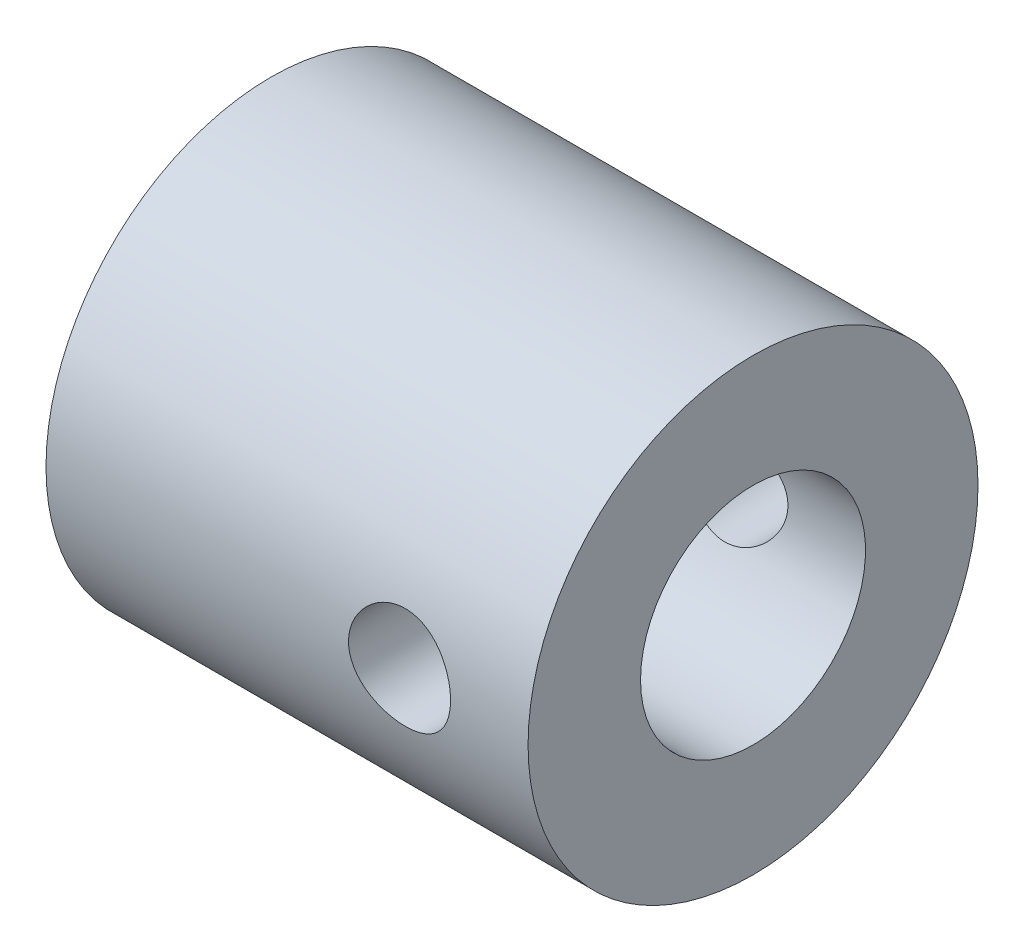
from build123d import *

# Parameters (mm, degrees)
SKETCH1_W               = 7.5
SKETCH1_H               = 3.5
SKETCH8_R               = 1.75
CUT_EXTRUDE6_DEPTH      = 10
CUT_EXTRUDE7_DEPTH      = 9.986100378
CUT_EXTRUDE7_DEPTH_BACK = 9.986100378
SKETCH9_R               = 0.79375


with BuildPart() as part:
    # Sketch1 → Revolve1 (revolve)
    with BuildSketch(Plane.XY, mode=Mode.PRIVATE) as revolve1_sk:
        with Locations((3.75, 1.75)):
            Rectangle(SKETCH1_W, SKETCH1_H)
    revolve(revolve1_sk.sketch.rotate(Axis((-11.701807229, 0, 0), (1, 0, 0)), 90), axis=Axis((-11.701807229, 0, 0), (1, 0, 0)))

    # Sketch8 → Cut-Extrude6 (cut)
    with BuildSketch(Plane.ZY):
        Circle(SKETCH8_R)
    extrude(amount=-CUT_EXTRUDE6_DEPTH, mode=Mode.SUBTRACT)

    # Sketch9 → Cut-Extrude7 (cut, two sides: drawn at the far end of the back side and taken through both)
    with BuildSketch(Plane.XY.offset(-CUT_EXTRUDE7_DEPTH_BACK)):
        with Locations((5.5, 0)):
            Circle(SKETCH9_R)
    extrude(amount=CUT_EXTRUDE7_DEPTH + CUT_EXTRUDE7_DEPTH_BACK, mode=Mode.SUBTRACT)


solid = part.part
